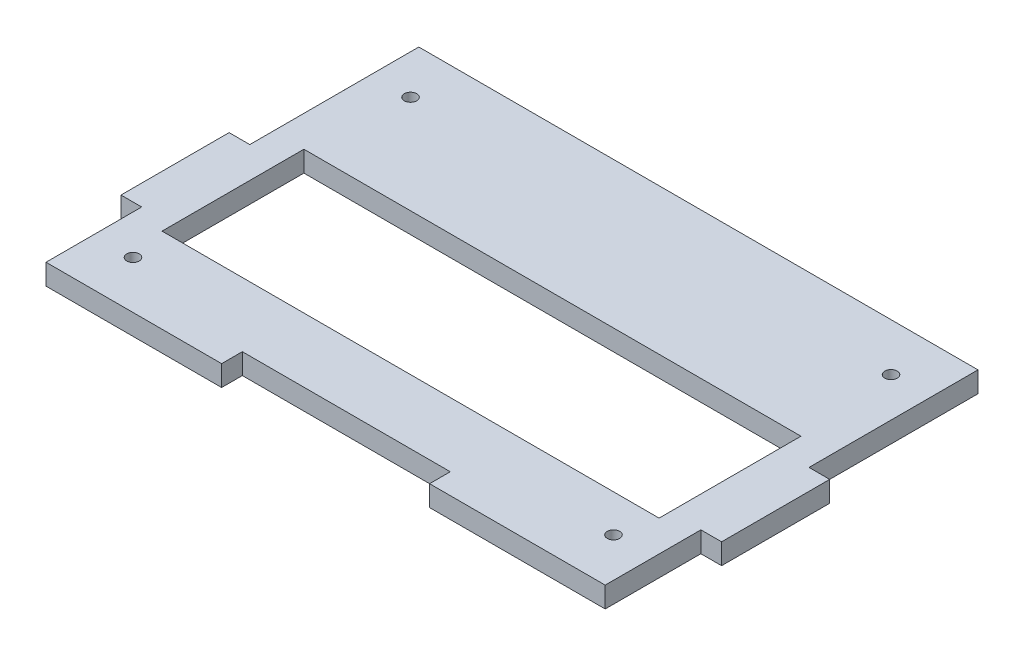
from build123d import *

# Parameters (mm, degrees)
SKETCH1_W           = 145
SKETCH1_H           = 90
BOSS_EXTRUDE1_DEPTH = 5
SKETCH3_W           = 120
SKETCH3_H           = 34.25
CUT_EXTRUDE1_DEPTH  = 5
SKETCH4_W           = 5
SKETCH4_H           = 40.8
SKETCH4_H_2         = 23.1
CUT_EXTRUDE2_DEPTH  = 5
SKETCH7_W           = 50.2
SKETCH7_H           = 5
CUT_EXTRUDE3_DEPTH  = 5
SKETCH9_R           = 1.5
CUT_EXTRUDE4_DEPTH  = 10


with BuildPart() as part:
    # Sketch1 → Boss-Extrude1 (new body)
    with BuildSketch(Plane(origin=(0, 0, 0), x_dir=(1, 0, 0), z_dir=(0, 1, 0))):
        Rectangle(SKETCH1_W, SKETCH1_H)
    extrude(amount=BOSS_EXTRUDE1_DEPTH)

    # Sketch3 → Cut-Extrude1 (cut)
    with BuildSketch(Plane(origin=(0, 5, 0), x_dir=(1, 0, 0), z_dir=(0, 1, 0))):
        with Locations((0, -7.365)):
            Rectangle(SKETCH3_W, SKETCH3_H)
    extrude(amount=-CUT_EXTRUDE1_DEPTH, mode=Mode.SUBTRACT)

    # Sketch4 → Cut-Extrude2 (cut)
    with BuildSketch(Plane(origin=(0, 5, 0), x_dir=(1, 0, 0), z_dir=(0, 1, 0))):
        with Locations((-70, 24.6)):
            Rectangle(SKETCH4_W, SKETCH4_H)
        with Locations((-70, -33.45)):
            Rectangle(SKETCH4_W, SKETCH4_H_2)
        with Locations((70, -33.45)):
            Rectangle(SKETCH4_W, SKETCH4_H_2)
        with Locations((70, 24.6)):
            Rectangle(SKETCH4_W, SKETCH4_H)
    extrude(amount=-CUT_EXTRUDE2_DEPTH, mode=Mode.SUBTRACT)

    # Sketch7 → Cut-Extrude3 (cut)
    with BuildSketch(Plane(origin=(0, 5, 0), x_dir=(1, 0, 0), z_dir=(0, 1, 0))):
        with Locations((0, -42.5)):
            Rectangle(SKETCH7_W, SKETCH7_H)
    extrude(amount=-CUT_EXTRUDE3_DEPTH, mode=Mode.SUBTRACT)

    # Sketch9 → Cut-Extrude4 (cut)
    with BuildSketch(Plane(origin=(0, 5, 0), x_dir=(1, 0, 0), z_dir=(0, 1, 0))):
        with Locations(Location((-58, 33.5, 0), (0, 0, 270))):
            Circle(SKETCH9_R)
        with Locations(Location((58, 33.5, 0), (0, 0, 270))):
            Circle(SKETCH9_R)
        with Locations(Location((58, -33.5, 0), (0, 0, 270))):
            Circle(SKETCH9_R)
        with Locations(Location((-58, -33.5, 0), (0, 0, 270))):
            Circle(SKETCH9_R)
    extrude(amount=-CUT_EXTRUDE4_DEPTH, mode=Mode.SUBTRACT)


solid = part.part
